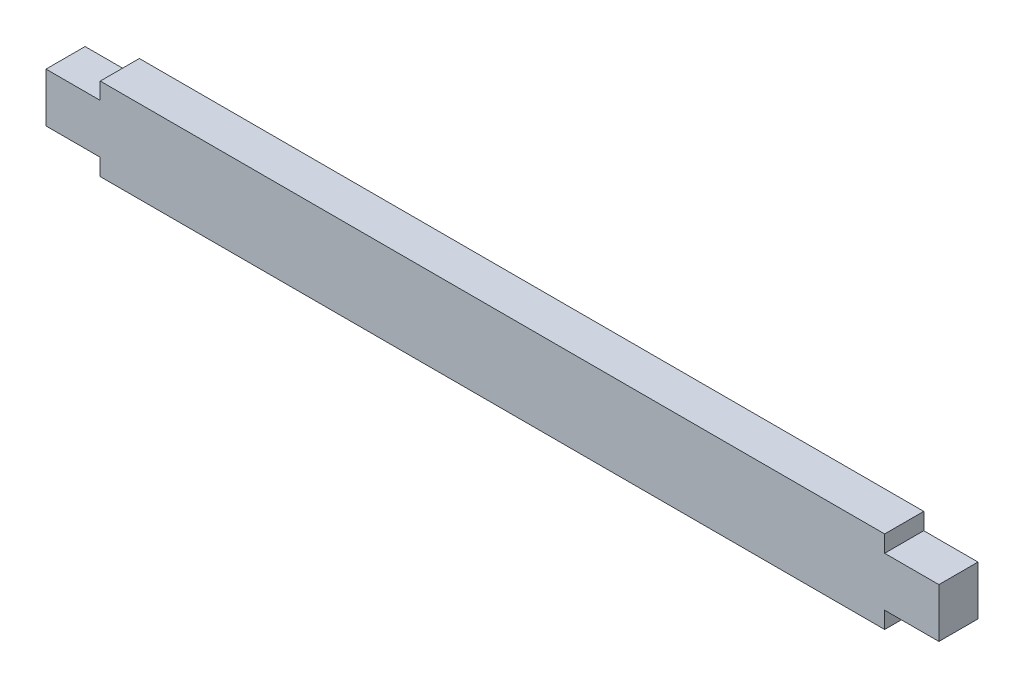
from build123d import *

# Parameters (mm, degrees)
BOSS_EXTRUDE1_DEPTH = 6


with BuildPart() as part:
    # Sketch2 → Boss-Extrude1 (new body)
    with BuildSketch(Plane.XY.offset(37.489413459)):
        Polygon((-60.185082852, 232.306808404), (60.185082852, 232.306808404), (60.185082852, 229.736923893), (68.509638152, 229.736923893), (68.509638152, 222.176692915), (60.185082852, 222.176692915), (60.185082852, 219.606808404), (-60.185082852, 219.606808404), (-60.185082852, 222.176692915), (-68.509638152, 222.176692915), (-68.509638152, 229.736923893), (-60.185082852, 229.736923893), align=None)
    extrude(amount=BOSS_EXTRUDE1_DEPTH)


solid = part.part
